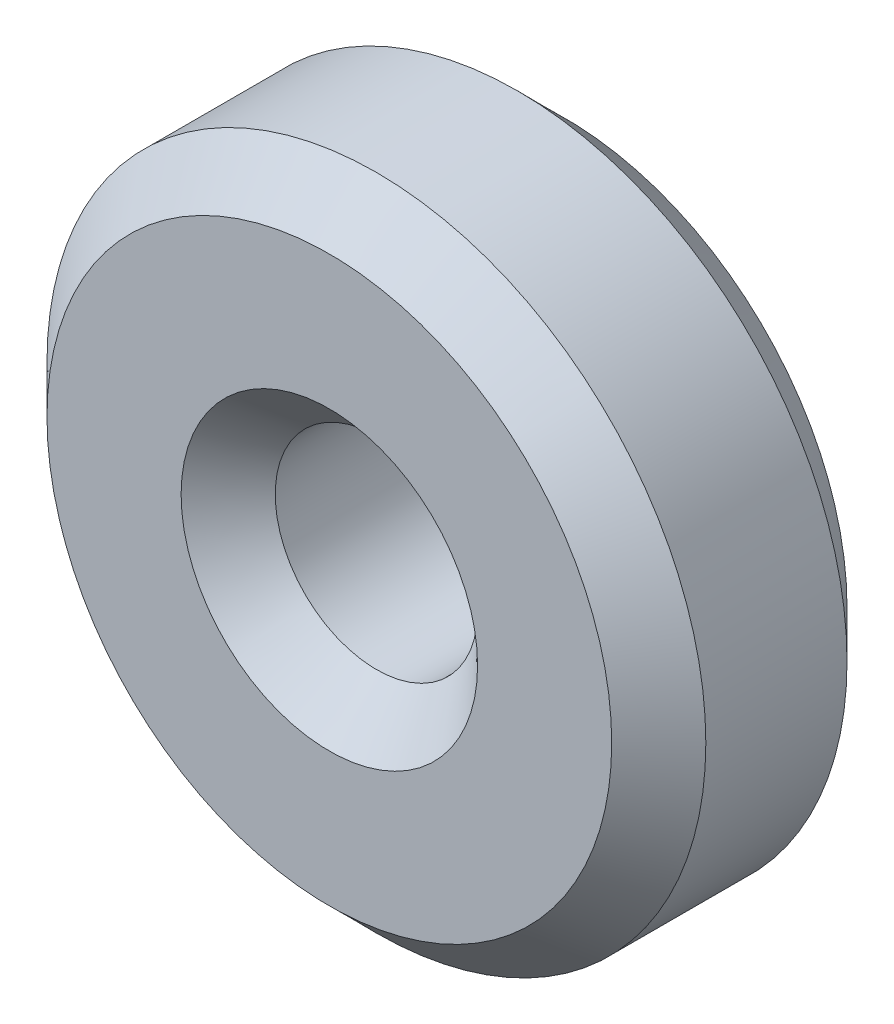
from build123d import *

# Parameters (mm, degrees)
SKETCH_1_R      = 7
SKETCH_1_R_2    = 2.15
EXTRUDE_1_DEPTH = 5
CHAMFER_1_SIZE  = 1


with BuildPart() as part:
    # Эскиз1 → Бобышка-Вытянуть1 (new body)
    with BuildSketch(Plane.XY):
        Circle(SKETCH_1_R)
        Circle(SKETCH_1_R_2, mode=Mode.SUBTRACT)
    extrude(amount=EXTRUDE_1_DEPTH)

    # Фаска1
    chamfer_1_edges = [part.edges().sort_by_distance(p)[0] for p in [
        (-7, 0, 0),
        (-7, 0, 5),
        (-2.15, 0, 0),
        (-2.15, 0, 5),
    ]]
    chamfer(chamfer_1_edges, length=CHAMFER_1_SIZE)


solid = part.part
